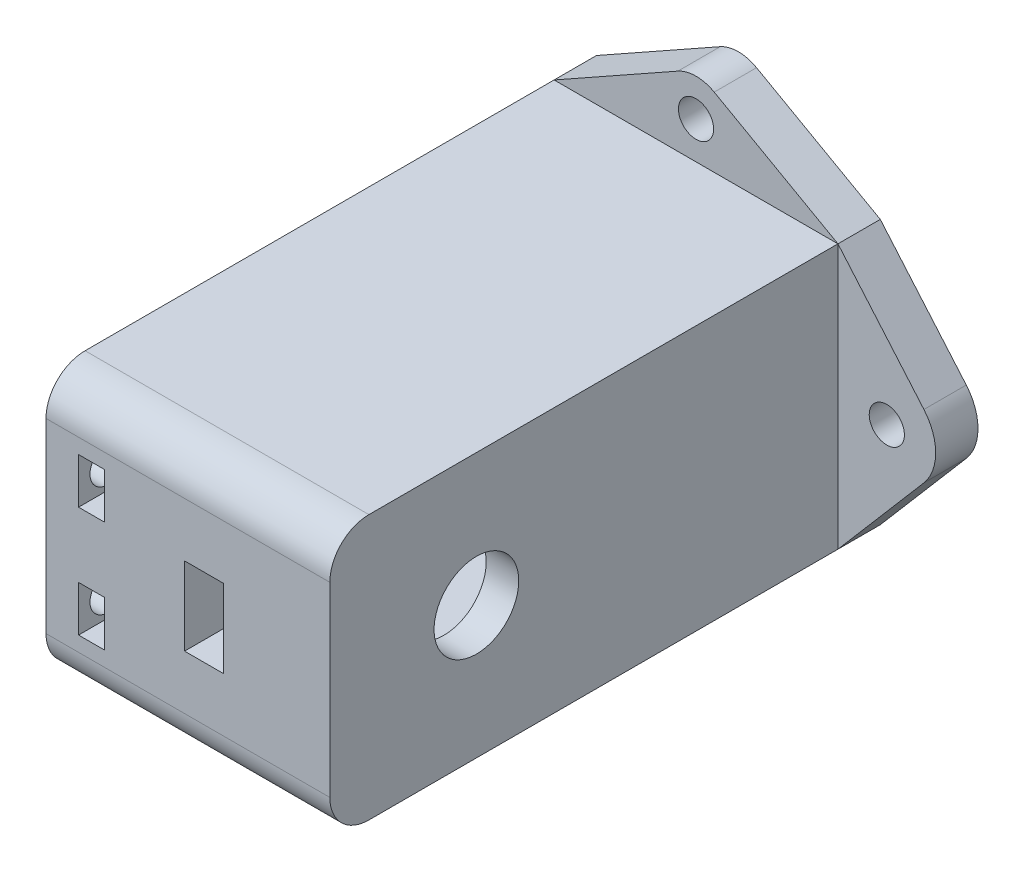
from build123d import *

# Parameters (mm, degrees)
SKETCH1_W           = 32.4
SKETCH1_H           = 15
BOSS_EXTRUDE1_DEPTH = 10
SKETCH4_W           = 26.527336133
SKETCH4_H           = 10
CUT_EXTRUDE2_DEPTH  = 80
SKETCH5_R           = 2.75
CUT_EXTRUDE3_DEPTH  = 20
BOSS_EXTRUDE2_DEPTH = 10
BOSS_EXTRUDE3_DEPTH = 75.5
SKETCH9_W           = 43.572663867
SKETCH9_H           = 40.6
BOSS_EXTRUDE4_DEPTH = 9
FILLET1_R           = 6
SKETCH10_R          = 2.75
CUT_EXTRUDE4_DEPTH  = 20
SKETCH11_W          = 4
SKETCH11_H          = 7
CUT_EXTRUDE5_DEPTH  = 122
SKETCH12_R          = 3
BOSS_EXTRUDE5_DEPTH = 1.2
SKETCH13_R          = 2.7
BOSS_EXTRUDE6_DEPTH = 6.5
SKETCH14_R          = 1.5
CUT_EXTRUDE6_DEPTH  = 8
SKETCH15_R          = 4.2
CUT_EXTRUDE7_DEPTH  = 8
BOSS_EXTRUDE9_DEPTH = 6.5
SKETCH17_R          = 2.7
CUT_EXTRUDE8_DEPTH  = 8
SKETCH18_W          = 6
SKETCH18_H          = 12
CUT_EXTRUDE9_DEPTH  = 23
SKETCH19_R          = 6.5
CUT_EXTRUDE10_DEPTH = 23


with BuildPart() as part:
    # Sketch1 → Boss-Extrude1 (new body)
    with BuildSketch(Plane.XY):
        with Locations((-3.3, 7.5)):
            Rectangle(SKETCH1_W, SKETCH1_H)
        with Locations((-3.3, -7.5)):
            Rectangle(SKETCH1_W, SKETCH1_H)
        with Locations((-35.7, -7.5)):
            Rectangle(SKETCH1_W, SKETCH1_H)
        with Locations((-35.7, 7.5)):
            Rectangle(SKETCH1_W, SKETCH1_H)
    extrude(amount=BOSS_EXTRUDE1_DEPTH)

    # Sketch4 → Cut-Extrude2 (cut)
    with BuildSketch(Plane(origin=(0, 15, 0), x_dir=(1, 0, 0), z_dir=(0, 1, 0))):
        with Locations((-38.636331934, -5)):
            Rectangle(SKETCH4_W, SKETCH4_H)
    extrude(amount=-CUT_EXTRUDE2_DEPTH, mode=Mode.SUBTRACT)

    # Sketch5 → Cut-Extrude3 (cut)
    with BuildSketch(Plane.ZY.offset(25.372663867)):
        with Locations(Location((5, -8.5, 0), (0, 0, 270))):
            Circle(SKETCH5_R)
        with Locations(Location((5, 8.5, 0), (0, 0, 270))):
            Circle(SKETCH5_R)
    extrude(amount=-CUT_EXTRUDE3_DEPTH, mode=Mode.SUBTRACT)

    # Sketch7 → Boss-Extrude2 (add)
    with BuildSketch(Plane(origin=(0, 0, 0), x_dir=(-1, 0, 0), z_dir=(0, 0, -1))):
        Polygon((-12.9, -15.3), (-13.2, -15.3), (-13.2, 15.3), (-12.9, 15.3), (25.372663867, 15.3), (25.372663867, 15), (-12.9, 15), (-12.9, -15), (25.372663867, -15), (25.372663867, -15.3), align=None)
    extrude(amount=-BOSS_EXTRUDE2_DEPTH)

    # Sketch8 → Boss-Extrude3 (add)
    with BuildSketch(Plane(origin=(0, 0, 0), x_dir=(-1, 0, 0), z_dir=(0, 0, -1))):
        Polygon((25.372663867, 15.3), (25.372663867, 20.3), (-13.2, 20.3), (-18.2, 20.3), (-18.2, -15.3), (-18.2, -20.3), (-13.2, -20.3), (25.372663867, -20.3), (25.372663867, -15.3), (-13.2, -15.3), (-13.2, 15.3), align=None)
    extrude(amount=-BOSS_EXTRUDE3_DEPTH)

    # Sketch9 → Boss-Extrude4 (add)
    with BuildSketch(Plane.XY.offset(75.5)):
        with Locations((-3.586331933, 0)):
            Rectangle(SKETCH9_W, SKETCH9_H)
    extrude(amount=BOSS_EXTRUDE4_DEPTH)

    # Fillet1
    fillet1_edges = [part.edges().sort_by_distance(p)[0] for p in [
        (-3.586331933, 20.3, 84.5),
        (-3.586331933, -20.3, 84.5),
    ]]
    fillet(fillet1_edges, radius=FILLET1_R)

    # Sketch10 → Cut-Extrude4 (cut)
    with BuildSketch(Plane.ZY.offset(25.372663867)):
        with Locations(Location((80, 8.5, 0), (0, 0, 270))):
            Circle(SKETCH10_R)
        with Locations(Location((80, -8.5, 0), (0, 0, 270))):
            Circle(SKETCH10_R)
    extrude(amount=-CUT_EXTRUDE4_DEPTH, mode=Mode.SUBTRACT)

    # Sketch11 → Cut-Extrude5 (cut)
    with BuildSketch(Plane.XY.offset(84.5)):
        with Locations((-18.372663867, -8.5)):
            Rectangle(SKETCH11_W, SKETCH11_H)
        with Locations((-18.372663867, 8.5)):
            Rectangle(SKETCH11_W, SKETCH11_H)
    extrude(amount=-CUT_EXTRUDE5_DEPTH, mode=Mode.SUBTRACT)

    # Sketch12 → Boss-Extrude5 (add)
    with BuildSketch(Plane(origin=(0, 0, 0), x_dir=(-1, 0, 0), z_dir=(0, 0, -1))):
        with Locations((26.5, 0)):
            Circle(SKETCH12_R)
    extrude(amount=-BOSS_EXTRUDE5_DEPTH)

    # Sketch13 → Boss-Extrude6 (add)
    # profile 1 of 2: a face of its own
    with BuildSketch(Plane.XY):
        with BuildLine():
            ThreePointArc((-6.377852766, 30.969649026), (-3.586331933, 31.7), (-0.794811101, 30.969649026))
            Line((-0.794811101, 30.969649026), (18.2, 20.3))
            Line((18.2, 20.3), (-25.372663867, 20.3))
            Line((-25.372663867, 20.3), (-6.377852766, 30.969649026))
        make_face()
        with Locations(Location((-3.586331933, 26, 0), (0, 0, 180))):
            Circle(SKETCH13_R, mode=Mode.SUBTRACT)
    # profile 2 of 2: a face of its own
    with BuildSketch(Plane.XY):
        with BuildLine():
            Line((-25.372663867, -20.3), (-6.377852766, -30.969649026))
            ThreePointArc((-6.377852766, -30.969649026), (-3.586331933, -31.7), (-0.794811101, -30.969649026))
            Line((-0.794811101, -30.969649026), (18.2, -20.3))
            Line((18.2, -20.3), (-25.372663867, -20.3))
        make_face()
        with Locations(Location((-3.586331933, -26, 0), (0, 0, 180))):
            Circle(SKETCH13_R, mode=Mode.SUBTRACT)
    extrude(amount=BOSS_EXTRUDE6_DEPTH)

    # Sketch14 → Cut-Extrude6 (cut)
    with BuildSketch(Plane(origin=(0, 0, 0), x_dir=(-1, 0, 0), z_dir=(0, 0, -1))):
        with Locations((18.749186637, 17.9)):
            Circle(SKETCH14_R)
        with Locations((-11.57652277, 17.9)):
            Circle(SKETCH14_R)
        with Locations((-11.57652277, -17.9)):
            Circle(SKETCH14_R)
        with Locations((18.749186637, -17.9)):
            Circle(SKETCH14_R)
    extrude(amount=-CUT_EXTRUDE6_DEPTH, mode=Mode.SUBTRACT)

    # Sketch15 → Cut-Extrude7 (cut)
    with BuildSketch(Plane.ZY.offset(-13.2)):
        with Locations((62, 0)):
            Circle(SKETCH15_R)
    extrude(amount=-CUT_EXTRUDE7_DEPTH, mode=Mode.SUBTRACT)

    # Sketch16 → Boss-Extrude9 (add)
    with BuildSketch(Plane(origin=(0, 0, 0), x_dir=(-1, 0, 0), z_dir=(0, 0, -1))):
        with BuildLine():
            Line((-31.398424222, -4.876265107), (-18.2, -20.3))
            Line((-18.2, -20.3), (-18.2, 20.3))
            Line((-18.2, 20.3), (-31.398424222, 4.876265107))
            ThreePointArc((-31.398424222, 4.876265107), (-33.2, 0), (-31.398424222, -4.876265107))
        make_face()
    extrude(amount=-BOSS_EXTRUDE9_DEPTH)

    # Sketch17 → Cut-Extrude8 (cut)
    with BuildSketch(Plane(origin=(0, 0, 0), x_dir=(-1, 0, 0), z_dir=(0, 0, -1))):
        with Locations((-25.7, 0)):
            Circle(SKETCH17_R)
    extrude(amount=-CUT_EXTRUDE8_DEPTH, mode=Mode.SUBTRACT)

    # Sketch18 → Cut-Extrude9 (cut)
    with BuildSketch(Plane.XY.offset(84.5)):
        with Locations((-1.1, 0)):
            Rectangle(SKETCH18_W, SKETCH18_H)
    extrude(amount=-CUT_EXTRUDE9_DEPTH, mode=Mode.SUBTRACT)

    # Sketch19 → Cut-Extrude10 (cut)
    with BuildSketch(Plane(origin=(18.2, 0, 0), x_dir=(0, 0, -1), z_dir=(1, 0, 0))):
        with Locations((-62, 0)):
            Circle(SKETCH19_R)
    extrude(amount=-CUT_EXTRUDE10_DEPTH, mode=Mode.SUBTRACT)


solid = part.part
